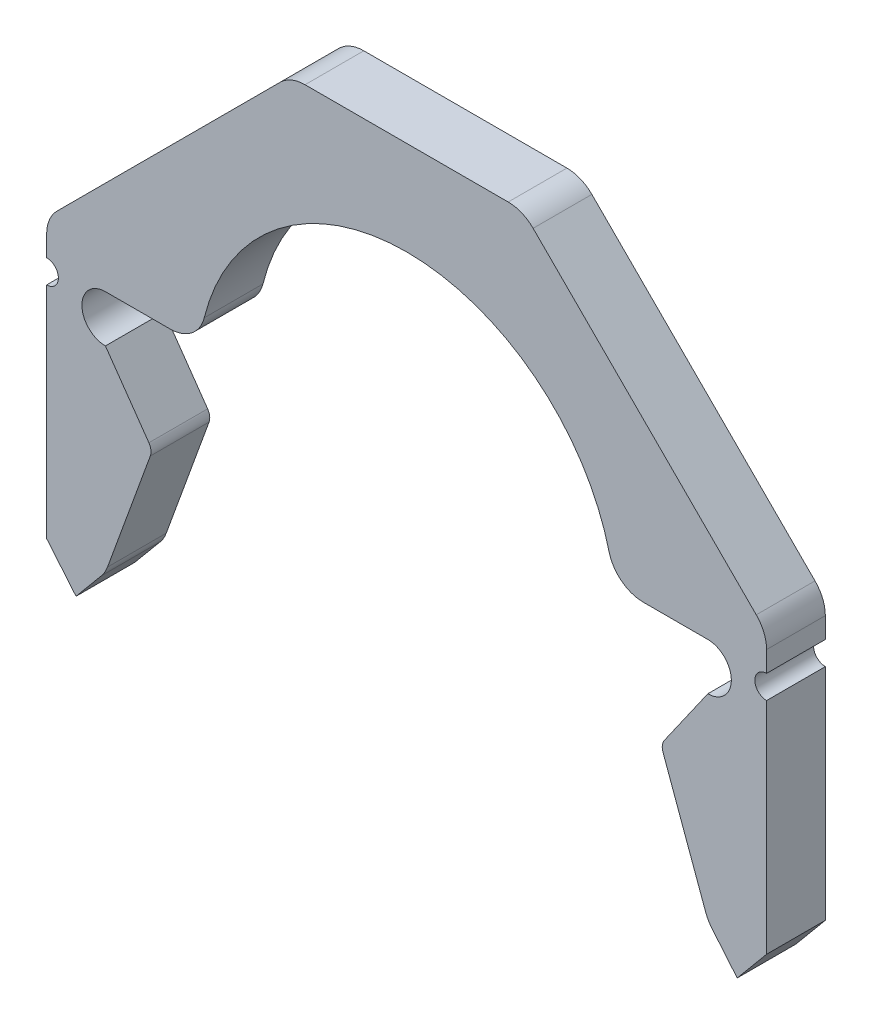
from build123d import *

# Parameters (mm, degrees)
BOSS_EXTRUDE1_DEPTH = 2.5
FILLET1_R           = 3
FILLET2_R           = 1


with BuildPart() as part:
    # Sketch1 → Boss-Extrude1 (new, symmetric)
    with BuildSketch(Plane.XY):
        with BuildLine():
            Line((17.636964024, 2), (25.636964024, 2))
            ThreePointArc((25.636964024, 2), (27.636964024, 0), (25.636964024, -2))
            Line((25.636964024, -2), (21.636964024, -7.712592027))
            Line((21.636964024, -7.712592027), (25.636964024, -18.702501705))
            Line((25.636964024, -18.702501705), (28.136964024, -21.702501705))
            Line((28.136964024, -21.702501705), (30.636964024, -18.702501705))
            Line((30.636964024, -18.702501705), (30.636964024, 0))
            ThreePointArc((30.636964024, 0), (29.636964024, 1), (30.636964024, 2))
            Line((30.636964024, 2), (30.636964024, 5))
            Line((30.636964024, 5), (9.886964024, 25.75))
            Line((9.886964024, 25.75), (-9.886964024, 25.75))
            Line((-9.886964024, 25.75), (-30.636964024, 5))
            Line((-30.636964024, 5), (-30.636964024, 2))
            ThreePointArc((-30.636964024, 2), (-29.636964024, 1), (-30.636964024, 0))
            Line((-30.636964024, 0), (-30.636964024, -18.702501705))
            Line((-30.636964024, -18.702501705), (-28.136964024, -21.702501705))
            Line((-28.136964024, -21.702501705), (-25.636964024, -18.702501705))
            Line((-25.636964024, -18.702501705), (-21.636964024, -7.712592027))
            Line((-21.636964024, -7.712592027), (-25.636964024, -2))
            ThreePointArc((-25.636964024, -2), (-27.636964024, 0), (-25.636964024, 2))
            Line((-25.636964024, 2), (-17.636964024, 2))
            ThreePointArc((-17.636964024, 2), (0, 17.75), (17.636964024, 2))
        make_face()
    extrude(amount=BOSS_EXTRUDE1_DEPTH, both=True)

    # Fillet1
    fillet1_edges = [part.edges().sort_by_distance(p)[0] for p in [
        (-25.636964024, -18.702501705, 0),
        (-30.636964024, 5, 0),
        (-9.886964024, 25.75, 0),
        (9.886964024, 25.75, 0),
        (30.636964024, 5, 0),
        (25.636964024, -18.702501705, 0),
        (17.636964024, 2, 0),
        (-17.636964024, 2, 0),
    ]]
    fillet(fillet1_edges, radius=FILLET1_R)

    # Fillet2
    fillet2_edges = [part.edges().sort_by_distance(p)[0] for p in [
        (-21.636964024, -7.712592027, 0),
        (21.636964024, -7.712592027, 0),
    ]]
    fillet(fillet2_edges, radius=FILLET2_R)


solid = part.part
